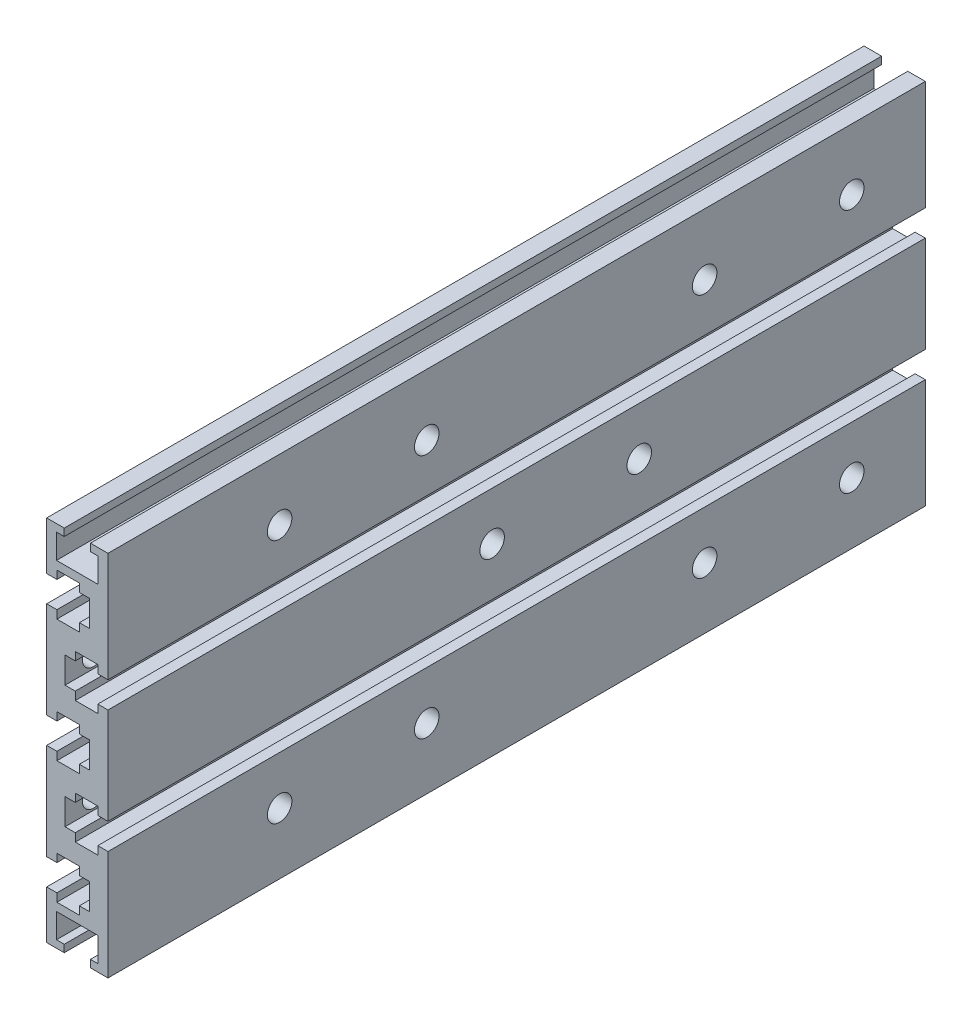
from build123d import *

# Parameters (mm, degrees)
EXTRUDE_1_DEPTH         = 200
HOLE_WIZARD_6_0_6_6_D   = 6
HOLE_WIZARD_5_5_5_5_1_D = 5.5


with BuildPart() as part:
    # Sketch1 → 凸台-拉伸1 (new body)
    with BuildSketch(Plane.XY):
        Polygon((-6.5, 45), (-3.2, 45), (-3.2, 43.2), (-5.1, 43.2), (-5.1, 37.2), (5.1, 37.2), (5.1, 43.2), (3.2, 43.2), (3.2, 45), (6.5, 45), (7.5, 45), (7.5, 44), (7.5, 18.2), (5, 18.2), (5, 20.2), (-0.5, 20.2), (-0.5, 18.2), (-3, 18.2), (-3, 11.8), (-0.5, 11.8), (-0.5, 9.8), (5, 9.8), (5, 11.8), (7.5, 11.8), (7.5, -11.8), (5, -11.8), (5, -9.8), (-0.5, -9.8), (-0.5, -11.8), (-3, -11.8), (-3, -18.2), (-0.5, -18.2), (-0.5, -20.2), (5, -20.2), (5, -18.2), (7.5, -18.2), (7.5, -44), (7.5, -45), (6.5, -45), (3.2, -45), (3.2, -43.2), (5.1, -43.2), (5.1, -37.2), (-5.1, -37.2), (-5.1, -43.2), (-3.2, -43.2), (-3.2, -45), (-6.496721962, -45), (-7.5, -45), (-7.5, -44), (-7.5, -33.2), (-5, -33.2), (-5, -35.2), (0.5, -35.2), (0.5, -33.2), (3, -33.2), (3, -26.8), (0.5, -26.8), (0.5, -24.8), (-5, -24.8), (-5, -26.8), (-7.5, -26.8), (-7.5, -3.2), (-5, -3.2), (-5, -5.2), (0.5, -5.2), (0.5, -3.2), (3, -3.2), (3, 3.2), (0.5, 3.2), (0.5, 5.2), (-5, 5.2), (-5, 3.2), (-7.5, 3.2), (-7.5, 26.8), (-5, 26.8), (-5, 24.8), (0.5, 24.8), (0.5, 26.8), (3, 26.8), (3, 33.2), (0.5, 33.2), (0.5, 35.2), (-5, 35.2), (-5, 33.2), (-7.5, 33.2), (-7.5, 44), (-7.5, 45), align=None)
    extrude(amount=EXTRUDE_1_DEPTH)

    # Ø6.0 (6) 直径孔6 (through all)
    with Locations(Plane(origin=(7.5, 0, 0), x_dir=(0, 0, -1), z_dir=(1, 0, 0))):
        with Locations((-158, -30), (-158, 30), (-122, -30), (-122, 30), (-54, 30), (-54, -30), (-18, -30), (-18, 30), (-106, 0), (-70, 0)):
            Hole(HOLE_WIZARD_6_0_6_6_D / 2)

    # Ø5.5 (5.5) 直径孔1 (through all)
    with Locations(Plane(origin=(-3, 0, 0), x_dir=(0, 0, -1), z_dir=(1, 0, 0))):
        with Locations((-193, -15), (-193, 15), (-7, -15), (-7, 15)):
            Hole(HOLE_WIZARD_5_5_5_5_1_D / 2)


solid = part.part
